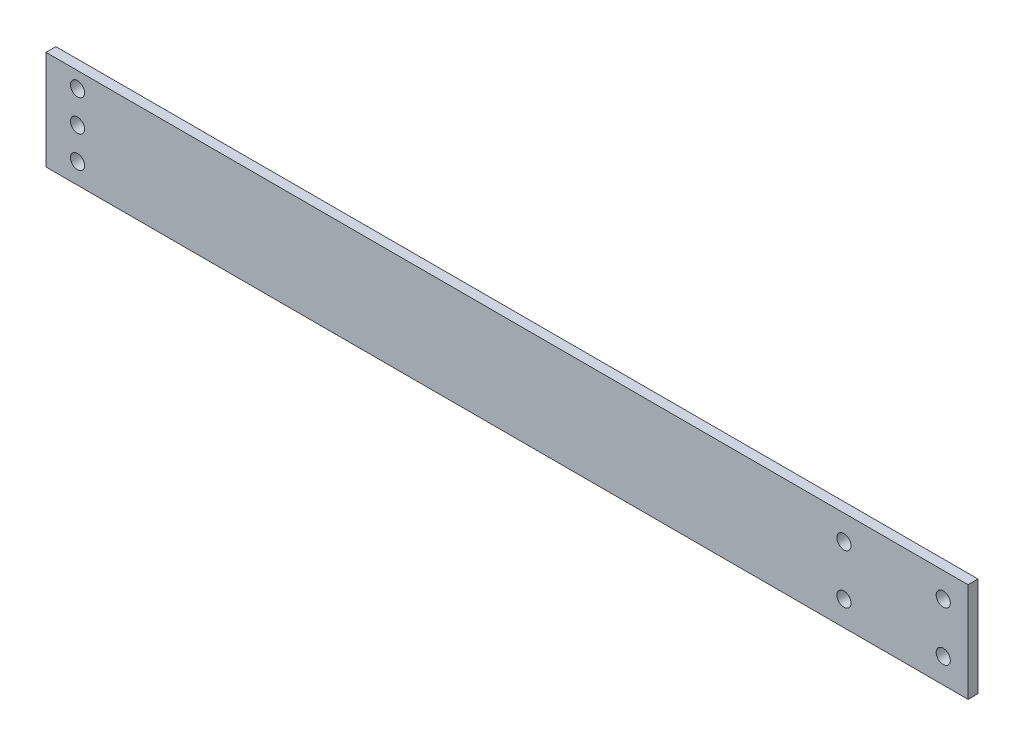
from build123d import *

# Parameters (mm, degrees)
SKETCH1_W           = 185.71
SKETCH1_H           = 20
BOSS_EXTRUDE1_DEPTH = 2
CUT_EXTRUDE1_REACH  = 95.413
SKETCH2_R           = 1.4224


with BuildPart() as part:
    # Sketch1 → Boss-Extrude1 (new body)
    with BuildSketch(Plane.XY):
        Rectangle(SKETCH1_W, SKETCH1_H)
    extrude(amount=BOSS_EXTRUDE1_DEPTH)

    # Sketch2 → Cut-Extrude1 (cut, up to next)
    with BuildSketch(Plane.XY.offset(2), mode=Mode.PRIVATE) as cut_extrude1_sk1:
        with Locations((-86.505, 6.825)):
            Circle(SKETCH2_R)
    cut_extrude1_tool1 = extrude(cut_extrude1_sk1.sketch, amount=-CUT_EXTRUDE1_REACH, mode=Mode.PRIVATE) & part.part
    # Sketch2 → Cut-Extrude1 (cut, up to next)
    with BuildSketch(Plane.XY.offset(2), mode=Mode.PRIVATE) as cut_extrude1_sk2:
        with Locations((-86.505, 0.475)):
            Circle(SKETCH2_R)
    cut_extrude1_tool2 = extrude(cut_extrude1_sk2.sketch, amount=-CUT_EXTRUDE1_REACH, mode=Mode.PRIVATE) & part.part
    # Sketch2 → Cut-Extrude1 (cut, up to next)
    with BuildSketch(Plane.XY.offset(2), mode=Mode.PRIVATE) as cut_extrude1_sk3:
        with Locations((-86.505, -5.875)):
            Circle(SKETCH2_R)
    cut_extrude1_tool3 = extrude(cut_extrude1_sk3.sketch, amount=-CUT_EXTRUDE1_REACH, mode=Mode.PRIVATE) & part.part
    # Sketch2 → Cut-Extrude1 (cut, up to next)
    with BuildSketch(Plane.XY.offset(2), mode=Mode.PRIVATE) as cut_extrude1_sk4:
        with Locations((87.855, 5)):
            Circle(SKETCH2_R)
    cut_extrude1_tool4 = extrude(cut_extrude1_sk4.sketch, amount=-CUT_EXTRUDE1_REACH, mode=Mode.PRIVATE) & part.part
    # Sketch2 → Cut-Extrude1 (cut, up to next)
    with BuildSketch(Plane.XY.offset(2), mode=Mode.PRIVATE) as cut_extrude1_sk5:
        with Locations((67.855, 5)):
            Circle(SKETCH2_R)
    cut_extrude1_tool5 = extrude(cut_extrude1_sk5.sketch, amount=-CUT_EXTRUDE1_REACH, mode=Mode.PRIVATE) & part.part
    # Sketch2 → Cut-Extrude1 (cut, up to next)
    with BuildSketch(Plane.XY.offset(2), mode=Mode.PRIVATE) as cut_extrude1_sk6:
        with Locations((67.855, -5)):
            Circle(SKETCH2_R)
    cut_extrude1_tool6 = extrude(cut_extrude1_sk6.sketch, amount=-CUT_EXTRUDE1_REACH, mode=Mode.PRIVATE) & part.part
    # Sketch2 → Cut-Extrude1 (cut, up to next)
    with BuildSketch(Plane.XY.offset(2), mode=Mode.PRIVATE) as cut_extrude1_sk7:
        with Locations((87.855, -5)):
            Circle(SKETCH2_R)
    cut_extrude1_tool7 = extrude(cut_extrude1_sk7.sketch, amount=-CUT_EXTRUDE1_REACH, mode=Mode.PRIVATE) & part.part
    add(cut_extrude1_tool1.solids().sort_by_distance((-86.505, 6.825, 2))[0], mode=Mode.SUBTRACT)
    add(cut_extrude1_tool2.solids().sort_by_distance((-86.505, 0.475, 2))[0], mode=Mode.SUBTRACT)
    add(cut_extrude1_tool3.solids().sort_by_distance((-86.505, -5.875, 2))[0], mode=Mode.SUBTRACT)
    add(cut_extrude1_tool4.solids().sort_by_distance((87.855, 5, 2))[0], mode=Mode.SUBTRACT)
    add(cut_extrude1_tool5.solids().sort_by_distance((67.855, 5, 2))[0], mode=Mode.SUBTRACT)
    add(cut_extrude1_tool6.solids().sort_by_distance((67.855, -5, 2))[0], mode=Mode.SUBTRACT)
    add(cut_extrude1_tool7.solids().sort_by_distance((87.855, -5, 2))[0], mode=Mode.SUBTRACT)


solid = part.part
